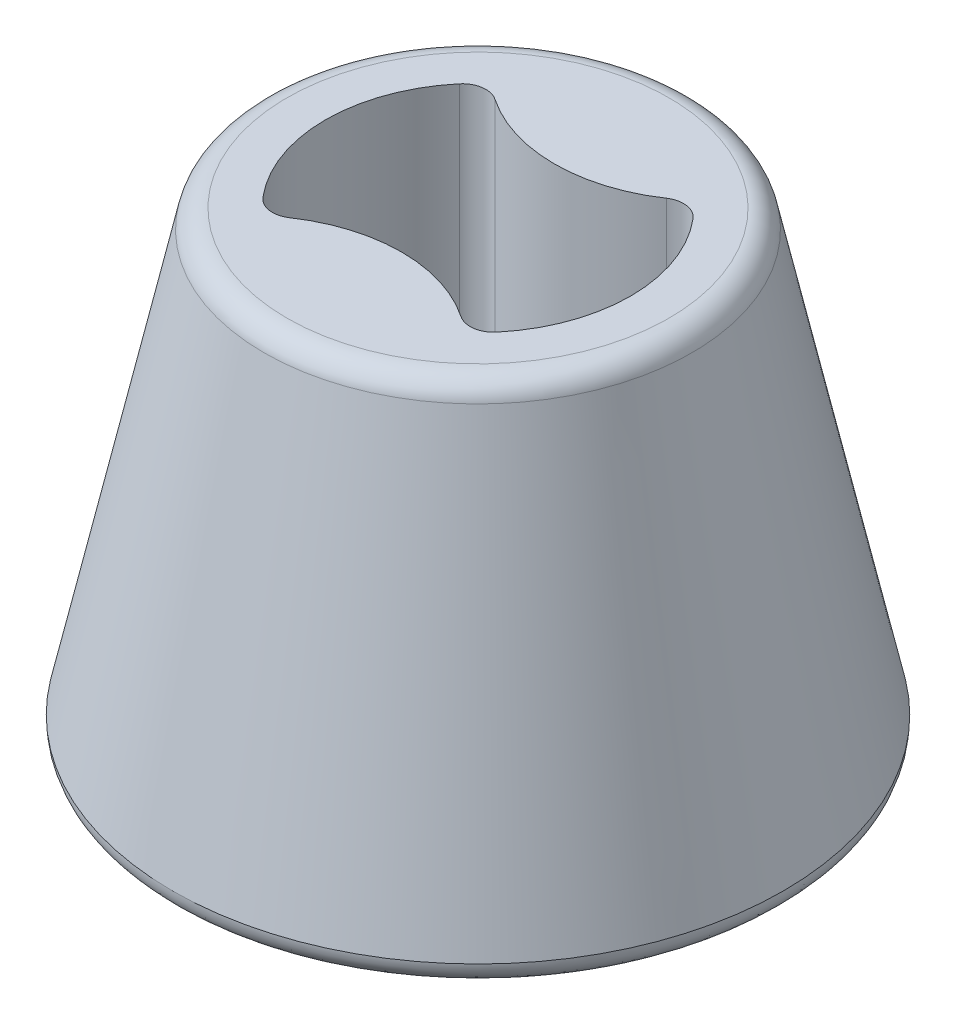
from build123d import *

# Parameters (mm, degrees)
SCALE1_SCALE       = 0.8125
CUT_EXTRUDE1_DEPTH = 10
FILLET1_R          = 1


with BuildPart() as part:
    # Sketch1 → Revolve2 (revolve)
    with BuildSketch(Plane.XY, mode=Mode.PRIVATE) as revolve2_sk:
        Polygon((0, 0), (16, 0), (11, 23), (0, 23), align=None)
    revolve(revolve2_sk.sketch.rotate(Axis((0, 0, 0), (0, 1, 0)), 90), axis=Axis((0, 0, 0), (0, 1, 0)))

    # Sketch3 → Revolve3 (revolve)
    with BuildSketch(Plane.XY, mode=Mode.PRIVATE) as revolve3_sk:
        with BuildLine():
            Line((5, 0), (0, 0))
            Line((0, 0), (0, -2))
            add(Edge.make_bspline(
                [(4.000120402, -1.988873118), (2.000904081, -2.014095318), (0, -2)],
                knots=[0.760291848, 0.760291848, 0.760291848, 1, 1, 1], degree=2))
            ThreePointArc((4.000120402, -1.988873118), (5.018538347, -2.970099866), (5.999765095, -1.951681921))
            add(Edge.make_bspline(
                [(9.001316848, -1.844407297), (8.504146741, -1.867898381), (7.503255878, -1.909143307), (6.502901353, -1.939136317), (5.999765095, -1.951681921)],
                knots=[0.460546637, 0.460546637, 0.460546637, 0.460546637, 0.549936439, 0.640414928, 0.640414928, 0.640414928, 0.640414928], degree=3))
            ThreePointArc((9.001316848, -1.844407297), (10.055317346, -2.787300024), (10.998210072, -1.733299527))
            add(Edge.make_bspline(
                [(16, 0), (16.005553276, -0.867365877), (14.502659499, -1.458274407), (12.624790808, -1.622454292), (11.359215178, -1.71007313), (10.998210072, -1.733299527)],
                knots=[0, 0, 0, 0, 0.112318716, 0.275650601, 0.340733812, 0.340733812, 0.340733812, 0.340733812], degree=3))
            Line((16, 0), (10, 0))
            Line((10, 0), (5, 0))
        make_face()
    revolve(revolve3_sk.sketch.rotate(Axis((0, 0, 0), (0, -1, 0)), 90), axis=Axis((0, 0, 0), (0, -1, 0)))


with BuildPart() as part_1:
    # Scale1: scaled about (0, 0, 0)
    add(part.part.scale(SCALE1_SCALE))

    # Sketch4 → Cut-Extrude1 (cut)
    with BuildSketch(Plane(origin=(0, 18.6875, 0), x_dir=(1, 0, 0), z_dir=(0, 1, 0))):
        with BuildLine():
            ThreePointArc((4.972997276, -4.185606061), (6.5, 0), (4.972997276, 4.185606061))
            ThreePointArc((4.972997276, 4.185606061), (4.345235079, 4.532194193), (3.646864669, 4.369444444))
            ThreePointArc((3.646864669, 4.369444444), (0, 3.25), (-3.646864669, 4.369444444))
            ThreePointArc((-3.646864669, 4.369444444), (-4.345235079, 4.532194193), (-4.972997276, 4.185606061))
            ThreePointArc((-4.972997276, 4.185606061), (-6.5, 0), (-4.972997276, -4.185606061))
            ThreePointArc((-4.972997276, -4.185606061), (-4.345235079, -4.532194193), (-3.646864669, -4.369444444))
            ThreePointArc((-3.646864669, -4.369444444), (0, -3.25), (3.646864669, -4.369444444))
            ThreePointArc((3.646864669, -4.369444444), (4.345235079, -4.532194193), (4.972997276, -4.185606061))
        make_face()
    extrude(amount=-CUT_EXTRUDE1_DEPTH, mode=Mode.SUBTRACT)

    # Fillet1
    fillet1_edges = [part_1.edges().sort_by_distance(p)[0] for p in [
        (0, 18.6875, 8.9375),
    ]]
    fillet(fillet1_edges, radius=FILLET1_R)


solid = part_1.part
